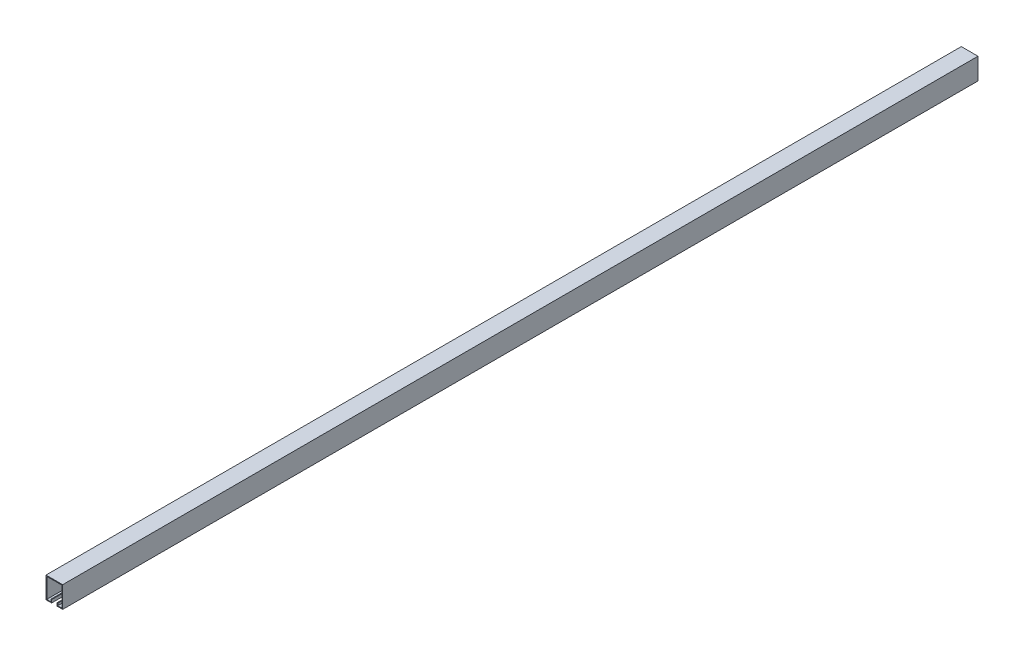
from build123d import *

# Parameters (mm, degrees)
CROQUIS1_W              = 44.45
CROQUIS1_H              = 57.15
SALIENTE_EXTRUIR1_DEPTH = 2440
CORTAR_EXTRUIR1_DEPTH   = 2440


with BuildPart() as part:
    # Croquis1 → Saliente-Extruir1 (new body)
    with BuildSketch(Plane.XY):
        with Locations((22.225, -28.575)):
            Rectangle(CROQUIS1_W, CROQUIS1_H)
    extrude(amount=SALIENTE_EXTRUIR1_DEPTH)

    # Croquis2 → Cortar-Extruir1 (cut)
    with BuildSketch(Plane.XY.offset(2440)):
        Polygon((15, -57.15), (15, -49.15), (13, -49.15), (13, -55.15), (2, -55.15), (2, -2), (42.45, -2), (42.45, -55.15), (31.45, -55.15), (31.45, -49.15), (29.45, -49.15), (29.45, -57.15), align=None)
    extrude(amount=-CORTAR_EXTRUIR1_DEPTH, mode=Mode.SUBTRACT)


solid = part.part
